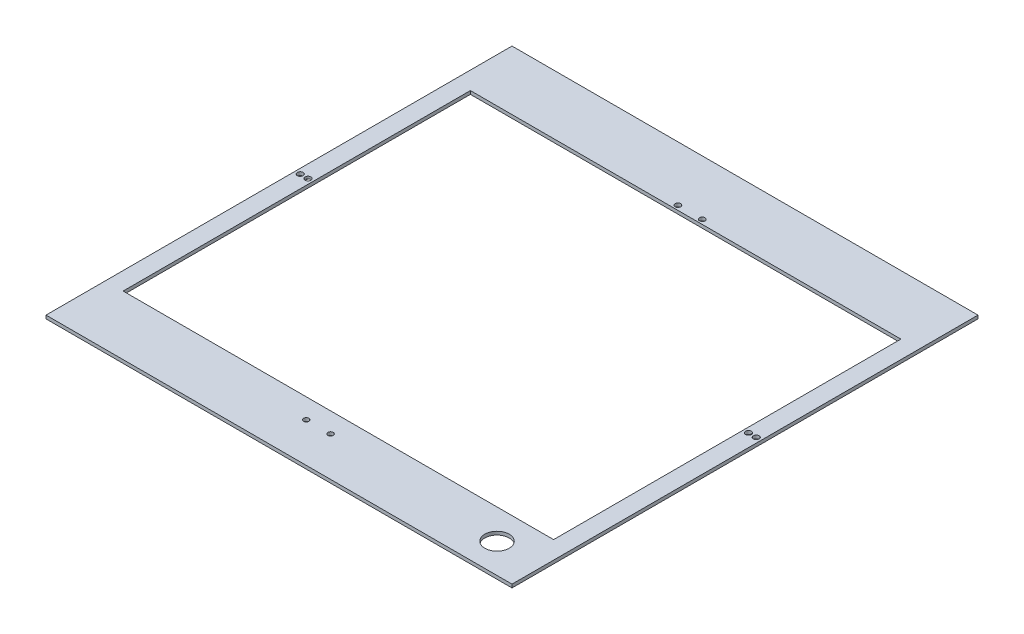
from build123d import *

# Parameters (mm, degrees)
SKETCH1_W           = 420
SKETCH1_H           = 420
SKETCH1_R           = 11
SKETCH1_W_2         = 388
SKETCH1_H_2         = 313
BOSS_EXTRUDE1_DEPTH = 3
SKETCH2_W           = 402.5
SKETCH2_H           = 332.5
SKETCH2_W_2         = 396.5
SKETCH2_H_2         = 326.5
CUT_EXTRUDE1_DEPTH  = 1
SKETCH5_R           = 2.6
SKETCH5_R_2         = 2.5
SKETCH5_R_3         = 2.4
CUT_EXTRUDE8_DEPTH  = 298


with BuildPart() as part:
    # Sketch1 → Boss-Extrude1 (new body)
    with BuildSketch(Plane(origin=(0, 0, 0), x_dir=(1, 0, 0), z_dir=(0, 1, 0))):
        Rectangle(SKETCH1_W, SKETCH1_H)
        with Locations((169.75, -183.25)):
            Circle(SKETCH1_R, mode=Mode.SUBTRACT)
        Rectangle(SKETCH1_W_2, SKETCH1_H_2, mode=Mode.SUBTRACT)
    extrude(amount=BOSS_EXTRUDE1_DEPTH)

    # Sketch2 → Cut-Extrude1 (cut)
    with BuildSketch(Plane.XZ):
        Rectangle(SKETCH2_W, SKETCH2_H)
        Rectangle(SKETCH2_W_2, SKETCH2_H_2, mode=Mode.SUBTRACT)
    extrude(amount=-CUT_EXTRUDE1_DEPTH, mode=Mode.SUBTRACT)

    # Sketch5 → Cut-Extrude8 (cut, through all)
    with BuildSketch(Plane(origin=(0, 3, 0), x_dir=(1, 0, 0), z_dir=(0, 1, 0))):
        with Locations((-205.5, 14.63)):
            Circle(SKETCH5_R)
        with Locations((-198.5, 14.63)):
            Circle(SKETCH5_R)
        with Locations((198.5, 14.63)):
            Circle(SKETCH5_R)
        with Locations((205.5, 14.63)):
            Circle(SKETCH5_R)
        with Locations((-11, 160.5)):
            Circle(SKETCH5_R_2)
        with Locations((11, 160.5)):
            Circle(SKETCH5_R_2)
        with Locations((-11, -174.5)):
            Circle(SKETCH5_R_3)
        with Locations((11, -174.5)):
            Circle(SKETCH5_R_3)
    extrude(amount=-CUT_EXTRUDE8_DEPTH, mode=Mode.SUBTRACT)


solid = part.part
